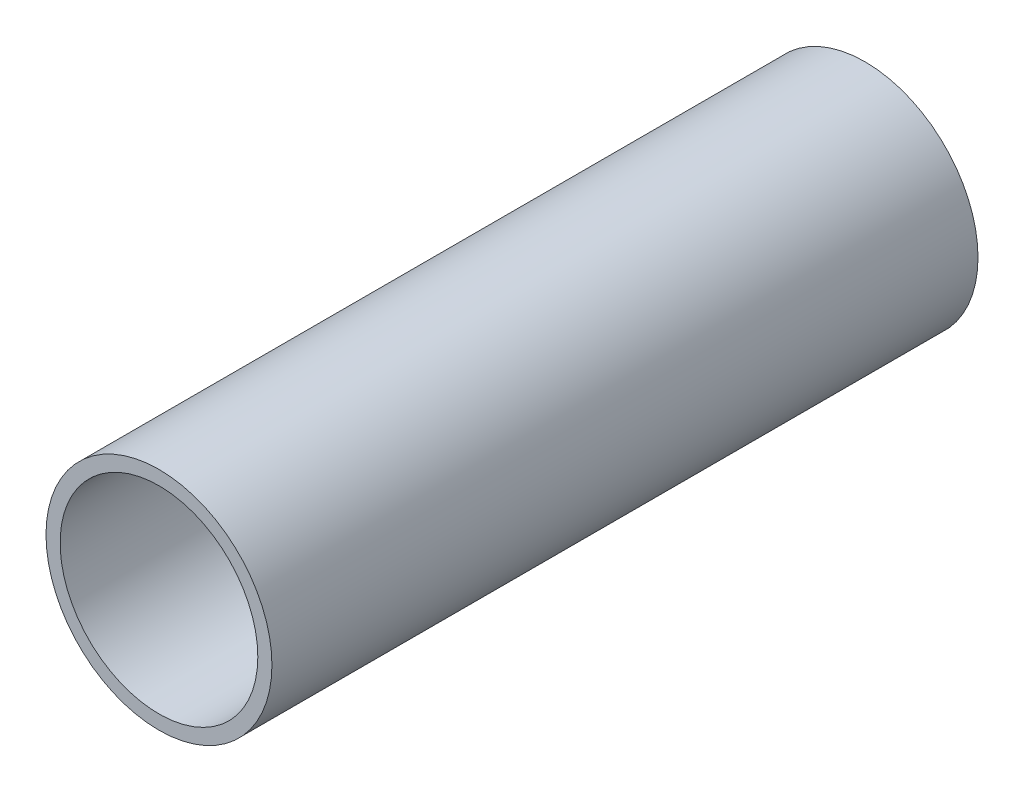
from build123d import *

# Parameters (mm, degrees)
SKETCH2_R           = 40
SKETCH2_R_2         = 35
BOSS_EXTRUDE1_DEPTH = 250


with BuildPart() as part:
    # Sketch2 → Boss-Extrude1 (new body)
    with BuildSketch(Plane.XY):
        Circle(SKETCH2_R)
        Circle(SKETCH2_R_2, mode=Mode.SUBTRACT)
    extrude(amount=BOSS_EXTRUDE1_DEPTH)


solid = part.part
